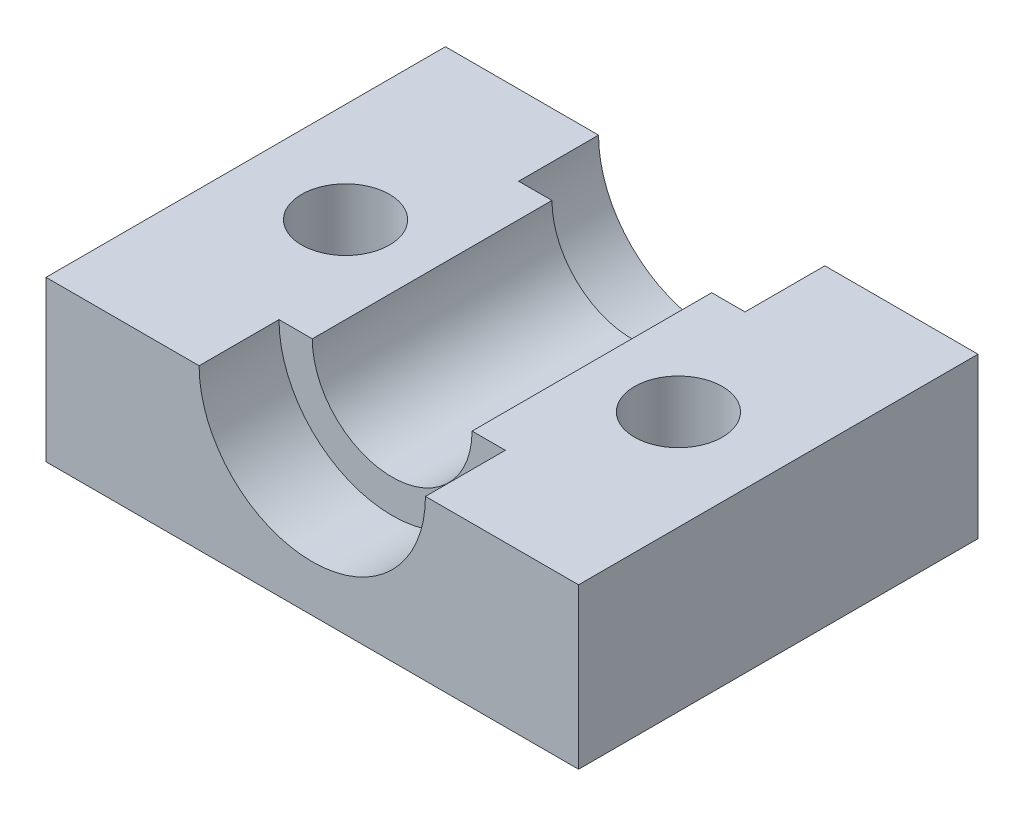
from build123d import *

# Parameters (mm, degrees)
EXTRUDE_1_DEPTH             = 24
EXTRUDE_1_DEPTH_BACK        = 6
EXTRUDE_2_DEPTH             = 18
HOLE_WIZARD_M61_D           = 6.6
HOLE_WIZARD_M61_CBORE_D     = 11
HOLE_WIZARD_M61_CBORE_DEPTH = 6.4


with BuildPart() as part:
    # Эскиз1 → Бобышка-Вытянуть1 (new, two sides: drawn at the far end of the back side and taken through both)
    with BuildSketch(Plane.XY.offset(-EXTRUDE_1_DEPTH_BACK)):
        with BuildLine():
            Line((28.5, 12), (40, 12))
            Line((40, 12), (40, 0))
            Line((40, 0), (0, 0))
            Line((0, 0), (0, 12))
            Line((0, 12), (11.5, 12))
            ThreePointArc((11.5, 12), (20, 3.5), (28.5, 12))
        make_face()
    extrude(amount=EXTRUDE_1_DEPTH + EXTRUDE_1_DEPTH_BACK)

    # Эскиз3 → Бобышка-Вытянуть2 (add)
    with BuildSketch(Plane.XY):
        with BuildLine():
            Line((11.5, 12), (14, 12))
            ThreePointArc((14, 12), (20, 6), (26, 12))
            Line((26, 12), (28.5, 12))
            ThreePointArc((28.5, 12), (20, 3.5), (11.5, 12))
        make_face()
    extrude(amount=EXTRUDE_2_DEPTH)

    # Цековка для  винта с внутренним шестигранником M61 (through all)
    with Locations(Plane.XZ):
        with Locations((7.5, 9), (32.5, 9)):
            CounterBoreHole(HOLE_WIZARD_M61_D / 2, HOLE_WIZARD_M61_CBORE_D / 2, HOLE_WIZARD_M61_CBORE_DEPTH)


solid = part.part
